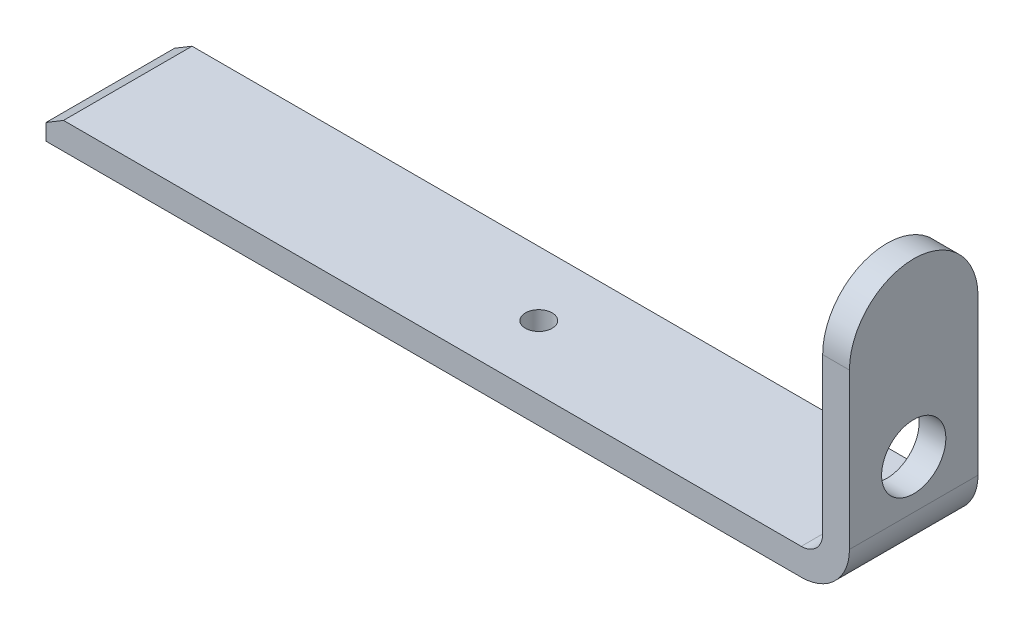
from build123d import *

# Parameters (mm, degrees)
SKETCH1_R           = 6
BOSS_EXTRUDE1_DEPTH = 150
CUT_EXTRUDE1_DEPTH  = 150
CUT_EXTRUDE2_DEPTH  = 150
SKETCH6_R           = 2.5
CUT_EXTRUDE3_DEPTH  = 150


with BuildPart() as part:
    # Sketch1 → Boss-Extrude1 (new body)
    with BuildSketch(Plane(origin=(0, 0, 0), x_dir=(0, 0, -1), z_dir=(1, 0, 0))):
        with BuildLine():
            Line((-10.816901408, 22.056338028), (-10.816901408, -15.943661972))
            Line((-10.816901408, -15.943661972), (13.183098592, -15.943661972))
            Line((13.183098592, -15.943661972), (13.183098592, 22.056338028))
            ThreePointArc((13.183098592, 22.056338028), (1.183098592, 34.056338028), (-10.816901408, 22.056338028))
        make_face()
        with Locations((1.183098592, 2.056338028)):
            Circle(SKETCH1_R, mode=Mode.SUBTRACT)
    extrude(amount=-BOSS_EXTRUDE1_DEPTH)

    # Sketch3 → Cut-Extrude1 (cut)
    with BuildSketch(Plane(origin=(0, 0, -13.183098592), x_dir=(-1, 0, 0), z_dir=(0, 0, -1))):
        with BuildLine():
            Line((5, 34.056338028), (5, -6.943661972))
            ThreePointArc((5, -6.943661972), (6.171572875, -9.772089097), (9, -10.943661972))
            Line((9, -10.943661972), (150, -10.943661972))
            Line((150, -10.943661972), (150, 34.056338028))
            Line((150, 34.056338028), (5, 34.056338028))
        make_face()
    extrude(amount=-CUT_EXTRUDE1_DEPTH, mode=Mode.SUBTRACT)

    # Sketch4 → Cut-Extrude2 (cut)
    with BuildSketch(Plane(origin=(0, 0, -13.183098592), x_dir=(-1, 0, 0), z_dir=(0, 0, -1))):
        Polygon((146.731773505, -10.943661972), (150, -12.910119048), (150, -10.943661972), align=None)
        with BuildLine():
            Line((0, -6.943663252), (0, -15.943661972))
            Line((0, -15.943661972), (8.999719534, -15.943661972))
            ThreePointArc((8.999719534, -15.943661972), (2.635939888, -13.307524671), (0, -6.943663252))
        make_face()
    extrude(amount=-CUT_EXTRUDE2_DEPTH, mode=Mode.SUBTRACT)

    # Sketch6 → Cut-Extrude3 (cut)
    with BuildSketch(Plane(origin=(0, -10.943661972, 0), x_dir=(1, 0, 0), z_dir=(0, 1, 0))):
        with Locations(Location((-70, 1.183098592, 0), (0, 0, 180))):
            Circle(SKETCH6_R)
    extrude(amount=-CUT_EXTRUDE3_DEPTH, mode=Mode.SUBTRACT)


solid = part.part
